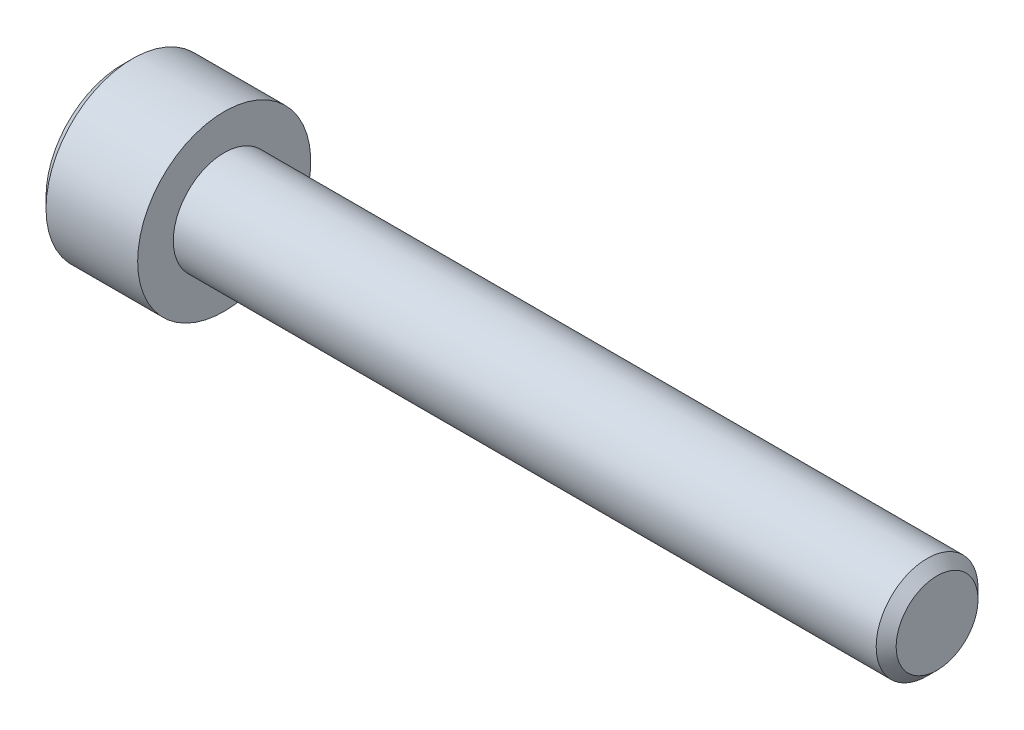
from build123d import *

# Parameters (mm, degrees)
CUT_EXTRUDE1_DEPTH = 2.5


with BuildPart() as part:
    # Sketch1 → Revolve1 (revolve)
    with BuildSketch(Plane.XY):
        Polygon((-5, 0), (35, 0), (35, -2.0095), (34.5095, -2.5), (0, -2.5), (0, -4.25), (-4.5, -4.25), (-5, -3.75), align=None)
    revolve(axis=Axis((-7, 0, 0), (1, 0, 0)))

    # Sketch2 → Cut-Extrude1 (cut)
    with BuildSketch(Plane.ZY.offset(5)):
        Polygon((0, 2.309401077), (-2, 1.154700538), (-2, -1.154700538), (0, -2.309401077), (2, -1.154700538), (2, 1.154700538), align=None)
    extrude(amount=-CUT_EXTRUDE1_DEPTH, mode=Mode.SUBTRACT)


solid = part.part
